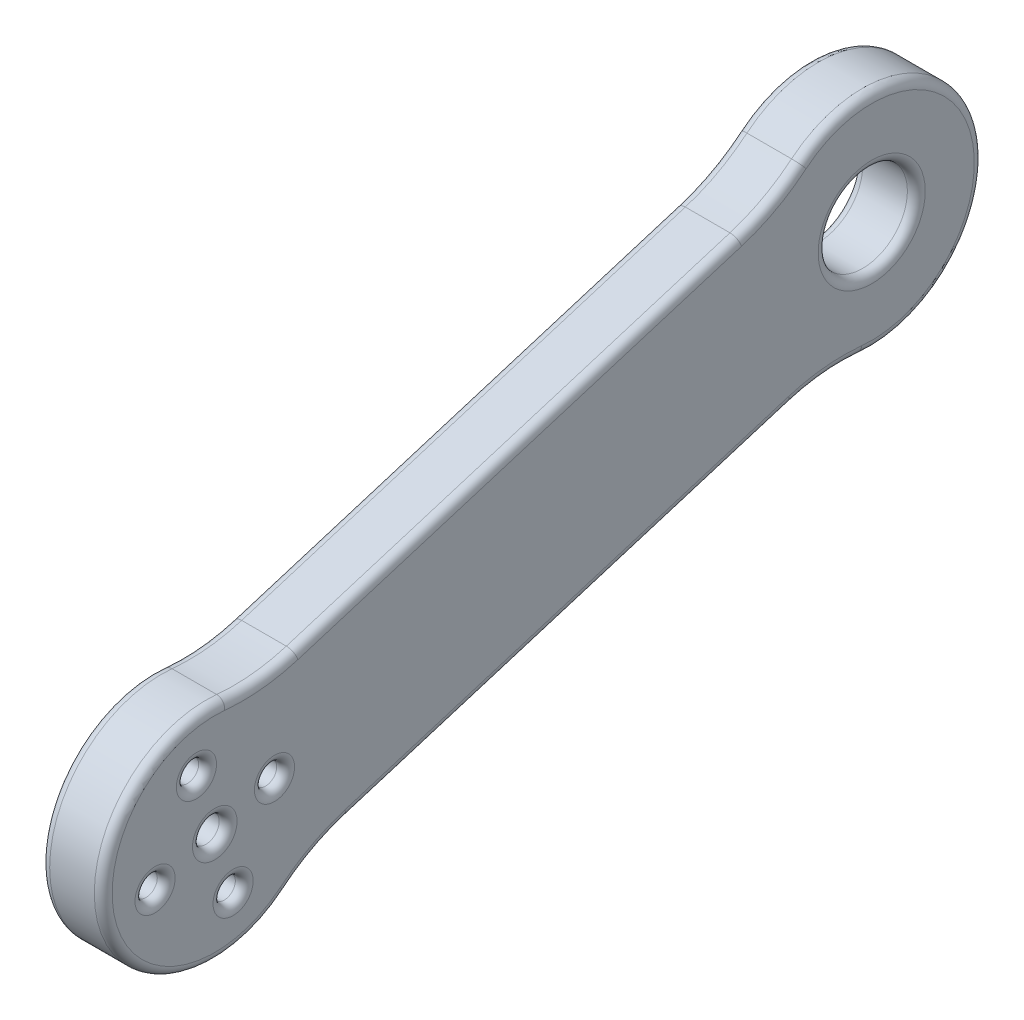
from build123d import *

# Parameters (mm, degrees)
SKETCH3_R           = 5
SKETCH3_R_2         = 1.25
SKETCH3_R_3         = 1.5
BOSS_EXTRUDE2_DEPTH = 7
FILLET2_R           = 1


with BuildPart() as part:
    # Sketch3 → Boss-Extrude2 (new body)
    with BuildSketch(Plane.YZ):
        with BuildLine():
            Line((74.314275071, -27.095634775), (59.059039264, 22.61631329))
            ThreePointArc((59.059039264, 22.61631329), (57.537050676, 26.252108965), (55.331579882, 29.518813424))
            ThreePointArc((55.331579882, 29.518813424), (61.284781292, 49.449987516), (77.393095295, 36.288888487))
            ThreePointArc((77.393095295, 36.288888487), (77.399624886, 32.347389177), (78.179019289, 28.483711678))
            Line((78.179019289, 28.483711678), (93.434255096, -21.228236387))
            ThreePointArc((93.434255096, -21.228236387), (94.956243684, -24.864032062), (97.161714478, -28.130736521))
            ThreePointArc((97.161714478, -28.130736521), (91.208513068, -48.061910612), (75.100199065, -34.900811584))
            ThreePointArc((75.100199065, -34.900811584), (75.093669473, -30.959312273), (74.314275071, -27.095634775))
        make_face()
        with Locations(Location((87.541389076, -36.111923097, 0), (0, 0, 270))):
            Circle(SKETCH3_R, mode=Mode.SUBTRACT)
        with Locations(Location((62.898315848, 44.191993009, 0), (0, 0, 270))):
            Circle(SKETCH3_R_2, mode=Mode.SUBTRACT)
        with Locations(Location((71.643898293, 39.553589436, 0), (0, 0, 270))):
            Circle(SKETCH3_R_2, mode=Mode.SUBTRACT)
        with Locations(Location((67.005494719, 30.808006991, 0), (0, 0, 270))):
            Circle(SKETCH3_R_2, mode=Mode.SUBTRACT)
        with Locations(Location((58.259912275, 35.446410564, 0), (0, 0, 270))):
            Circle(SKETCH3_R_2, mode=Mode.SUBTRACT)
        with Locations(Location((64.951905284, 37.5, 0), (0, 0, 270))):
            Circle(SKETCH3_R_3, mode=Mode.SUBTRACT)
    extrude(amount=BOSS_EXTRUDE2_DEPTH)

    # Fillet2
    fillet2_edges = [part.edges().sort_by_distance(p)[0] for p in [
        (0, 66.686657167, -2.239660742),
        (0, 57.537050676, 26.252108965),
        (0, 61.284781292, 49.449987516),
        (0, 77.399624886, 32.347389177),
        (7, 57.537050676, 26.252108965),
        (7, 66.686657167, -2.239660742),
        (7, 75.093669473, -30.959312273),
        (0, 87.541389076, -31.111923097),
        (7, 87.541389076, -31.111923097),
        (7, 91.208513068, -48.061910612),
        (0, 62.898315848, 45.441993009),
        (7, 62.898315848, 45.441993009),
        (7, 94.956243684, -24.864032062),
        (0, 71.643898293, 40.803589436),
        (7, 71.643898293, 40.803589436),
        (7, 85.806637192, 3.627737645),
        (0, 67.005494719, 32.058006991),
        (7, 67.005494719, 32.058006991),
        (0, 58.259912275, 36.696410564),
        (7, 58.259912275, 36.696410564),
        (0, 64.951905284, 39),
        (7, 64.951905284, 39),
        (7, 77.399624886, 32.347389177),
        (0, 85.806637192, 3.627737645),
        (7, 61.284781292, 49.449987516),
        (0, 94.956243684, -24.864032062),
        (0, 91.208513068, -48.061910612),
        (0, 75.093669473, -30.959312273),
    ]]
    fillet(fillet2_edges, radius=FILLET2_R)


solid = part.part
